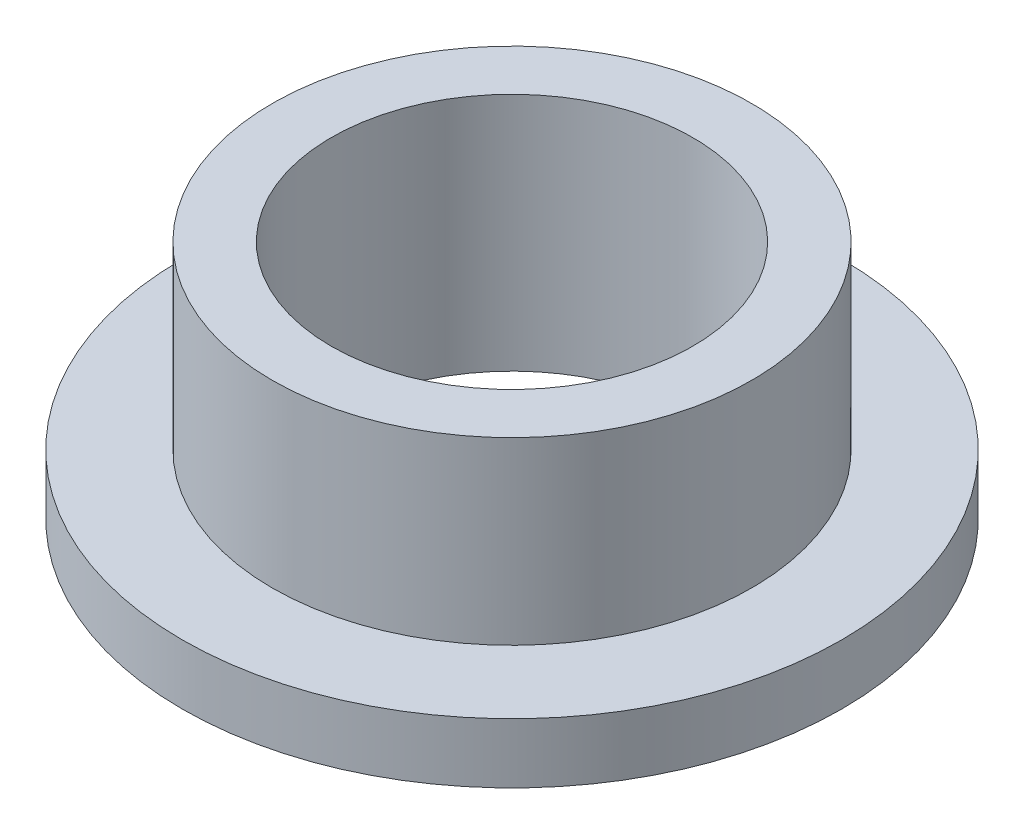
from build123d import *

# Parameters (mm, degrees)
SKETCH2_R           = 6.35
SKETCH2_R_2         = 4.7879
BOSS_EXTRUDE1_DEPTH = 6.35
SKETCH3_R           = 8.73125
SKETCH3_R_2         = 6.35
BOSS_EXTRUDE2_DEPTH = 1.5875


with BuildPart() as part:
    # Sketch2 → Boss-Extrude1 (new body)
    with BuildSketch(Plane(origin=(0, 0, 0), x_dir=(1, 0, 0), z_dir=(0, 1, 0))):
        with Locations(Location((0, 0, 0), (0, 0, 270))):
            Circle(SKETCH2_R)
        with Locations(Location((0, 0, 0), (0, 0, 270))):
            Circle(SKETCH2_R_2, mode=Mode.SUBTRACT)
    extrude(amount=BOSS_EXTRUDE1_DEPTH)

    # Sketch3 → Boss-Extrude2 (add)
    with BuildSketch(Plane(origin=(0, 0, 0), x_dir=(1, 0, 0), z_dir=(0, 1, 0))):
        with Locations(Location((0, 0, 0), (0, 0, 270))):
            Circle(SKETCH3_R)
        with Locations(Location((0, 0, 0), (0, 0, 270))):
            Circle(SKETCH3_R_2, mode=Mode.SUBTRACT)
    extrude(amount=BOSS_EXTRUDE2_DEPTH)


solid = part.part
